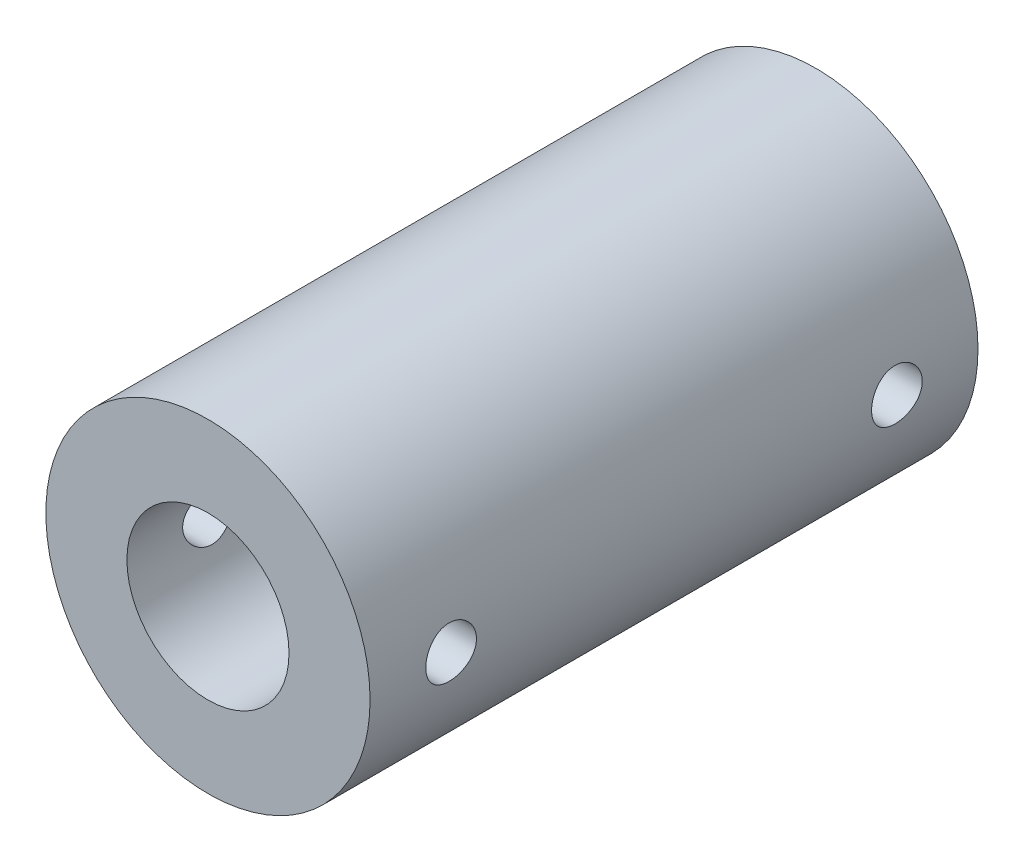
from build123d import *

# Parameters (mm, degrees)
SCHIZZO1_R                    = 8
ESTRUSIONE_ESTRUSIONE1_DEPTH  = 30
SCHIZZO2_R                    = 2.5
TAGLIO_ESTRUSIONE1_DEPTH      = 33.062439084
SCHIZZO3_R                    = 4
TAGLIO_ESTRUSIONE2_DEPTH      = 15
TAGLIO_ESTRUSIONE3_DEPTH      = 33.062439084
TAGLIO_ESTRUSIONE3_DEPTH_BACK = 33.062439084
SCHIZZO4_R                    = 1.25


with BuildPart() as part:
    # Schizzo1 → Estrusione-Estrusione1 (new body)
    with BuildSketch(Plane.XY):
        Circle(SCHIZZO1_R)
    extrude(amount=ESTRUSIONE_ESTRUSIONE1_DEPTH)

    # Schizzo2 → Taglio-Estrusione1 (cut, through all)
    with BuildSketch(Plane.XY.offset(30)):
        Circle(SCHIZZO2_R)
    extrude(amount=-TAGLIO_ESTRUSIONE1_DEPTH, mode=Mode.SUBTRACT)

    # Schizzo3 → Taglio-Estrusione2 (cut)
    with BuildSketch(Plane.XY.offset(30)):
        Circle(SCHIZZO3_R)
    extrude(amount=-TAGLIO_ESTRUSIONE2_DEPTH, mode=Mode.SUBTRACT)

    # Schizzo4 → Taglio-Estrusione3 (cut, two sides: drawn at the far end of the back side and taken through both)
    with BuildSketch(Plane(origin=(0, 0, 0), x_dir=(0, 0, -1), z_dir=(1, 0, 0)).offset(-TAGLIO_ESTRUSIONE3_DEPTH_BACK)):
        with Locations((-26, 0)):
            Circle(SCHIZZO4_R)
        with Locations((-4, 0)):
            Circle(SCHIZZO4_R)
    extrude(amount=TAGLIO_ESTRUSIONE3_DEPTH + TAGLIO_ESTRUSIONE3_DEPTH_BACK, mode=Mode.SUBTRACT)


solid = part.part
